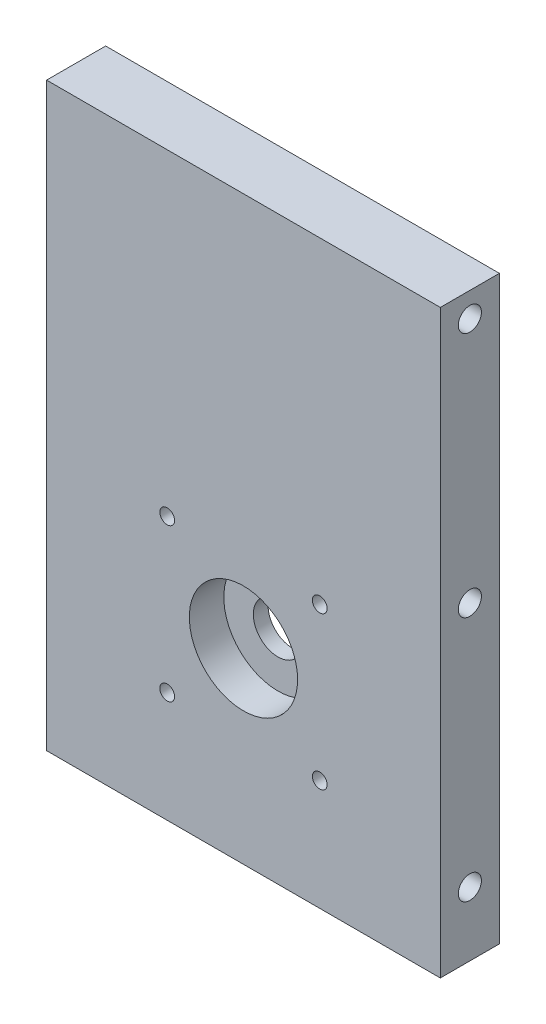
from build123d import *

# Parameters (mm, degrees)
CROQUIS1_W              = 80
CROQUIS1_H              = 110
CROQUIS1_R              = 5
CROQUIS1_R_2            = 1.5
SALIENTE_EXTRUIR1_DEPTH = 12
CROQUIS4_R              = 11.25
CORTAR_EXTRUIR2_DEPTH   = 2
CROQUIS5_R              = 2.35
CORTAR_EXTRUIR3_DEPTH   = 5
CORTAR_EXTRUIR4_START   = -5
CROQUIS6_R              = 2.35
CORTAR_EXTRUIR4_DEPTH   = 5
CROQUIS7_R              = 11
CORTAR_EXTRUIR5_DEPTH   = 7
CROQUIS8_W              = 80
CROQUIS8_H              = 8
SALIENTE_EXTRUIR2_DEPTH = 12


with BuildPart() as part:
    # Croquis1 → Saliente-Extruir1 (new body)
    with BuildSketch(Plane.XY):
        with Locations((40, 55)):
            Rectangle(CROQUIS1_W, CROQUIS1_H)
        with Locations((40, 30)):
            Circle(CROQUIS1_R, mode=Mode.SUBTRACT)
        with Locations((55.5, 45.5)):
            Circle(CROQUIS1_R_2, mode=Mode.SUBTRACT)
        with Locations((24.5, 45.5)):
            Circle(CROQUIS1_R_2, mode=Mode.SUBTRACT)
        with Locations((24.5, 14.5)):
            Circle(CROQUIS1_R_2, mode=Mode.SUBTRACT)
        with Locations((55.5, 14.5)):
            Circle(CROQUIS1_R_2, mode=Mode.SUBTRACT)
    extrude(amount=SALIENTE_EXTRUIR1_DEPTH)

    # Croquis4 → Cortar-Extruir2 (cut)
    with BuildSketch(Plane(origin=(0, 0, 0), x_dir=(-1, 0, 0), z_dir=(0, 0, -1))):
        with Locations((-40, 30)):
            Circle(CROQUIS4_R)
    extrude(amount=-CORTAR_EXTRUIR2_DEPTH, mode=Mode.SUBTRACT)

    # Croquis5 → Cortar-Extruir3 (cut)
    with BuildSketch(Plane(origin=(80, 0, 0), x_dir=(0, 0, -1), z_dir=(1, 0, 0))):
        with Locations(Location((-6, 105, 0), (0, 0, 90))):
            Circle(CROQUIS5_R)
        with Locations(Location((-6, 55, 0), (0, 0, 90))):
            Circle(CROQUIS5_R)
        with Locations(Location((-6, 5, 0), (0, 0, 90))):
            Circle(CROQUIS5_R)
    extrude(amount=-CORTAR_EXTRUIR3_DEPTH, mode=Mode.SUBTRACT)

    # Croquis6 → Cortar-Extruir4 (cut)
    with BuildSketch(Plane.ZY.offset(CORTAR_EXTRUIR4_START)):
        with Locations(Location((6, 105, 0), (0, 0, 90))):
            Circle(CROQUIS6_R)
        with Locations(Location((6, 55, 0), (0, 0, 90))):
            Circle(CROQUIS6_R)
        with Locations(Location((6, 5, 0), (0, 0, 90))):
            Circle(CROQUIS6_R)
    extrude(amount=CORTAR_EXTRUIR4_DEPTH, mode=Mode.SUBTRACT)

    # Croquis7 → Cortar-Extruir5 (cut)
    with BuildSketch(Plane.XY.offset(12)):
        with Locations((40, 30)):
            Circle(CROQUIS7_R)
    extrude(amount=-CORTAR_EXTRUIR5_DEPTH, mode=Mode.SUBTRACT)

    # Croquis8 → Saliente-Extruir2 (add)
    with BuildSketch(Plane.XY.offset(12)):
        with Locations((40, -4)):
            Rectangle(CROQUIS8_W, CROQUIS8_H)
    extrude(amount=-SALIENTE_EXTRUIR2_DEPTH)


solid = part.part
